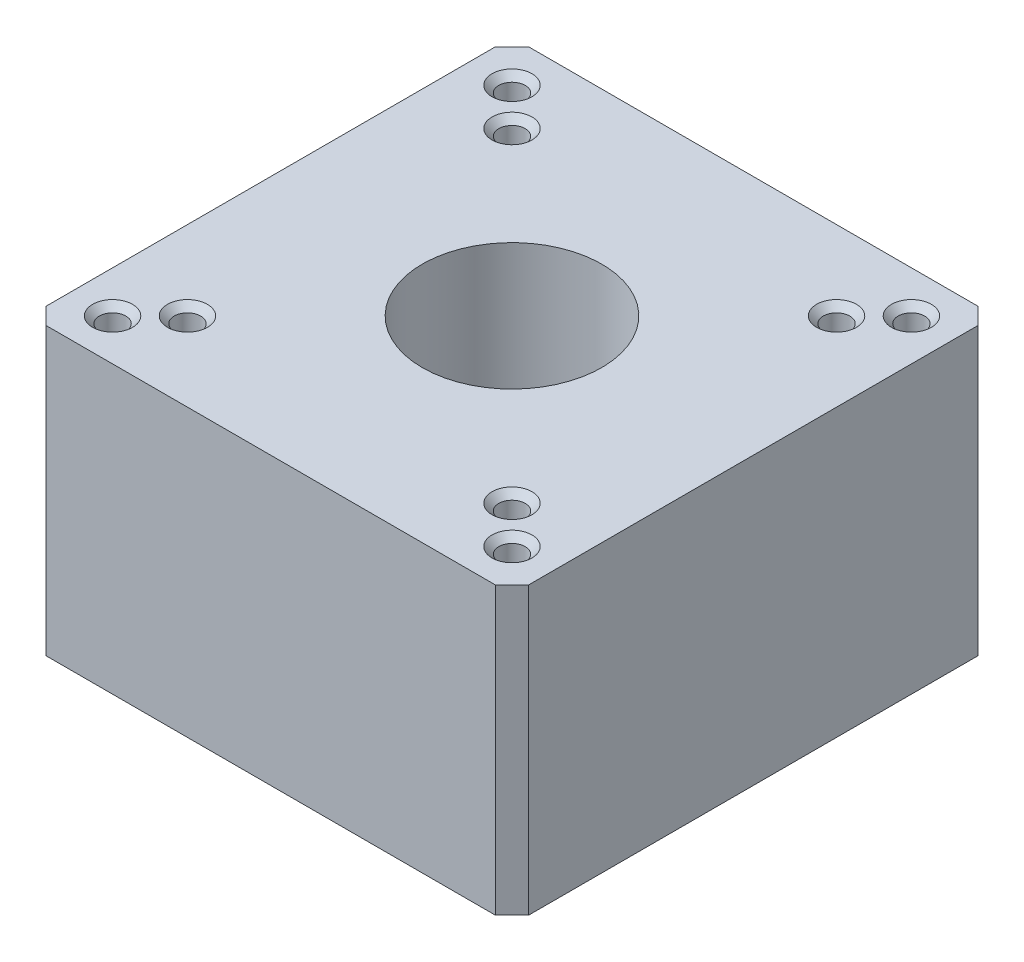
from build123d import *

# Parameters (mm, degrees)
SKETCH1_W                        = 73.66
SKETCH1_H                        = 73.66
SKETCH1_R                        = 13.6921875
BOSS_EXTRUDE1_DEPTH              = 43.65625
CHAMFER2_SIZE                    = 2.54
F_10_32_TAPPED_HOLE1_D           = 4.0386
F_10_32_TAPPED_HOLE1_CSINK_D     = 6.096
F_10_32_TAPPED_HOLE1_CSINK_ANGLE = 90
F_10_32_TAPPED_HOLE2_D           = 4.0386
F_10_32_TAPPED_HOLE2_DEPTH       = 21.844
F_10_32_TAPPED_HOLE2_CSINK_D     = 6.096
F_10_32_TAPPED_HOLE2_CSINK_ANGLE = 90
F_10_32_TAPPED_HOLE2_TIP         = 1.213317848


with BuildPart() as part:
    # Sketch1 → Boss-Extrude1 (new body)
    with BuildSketch(Plane(origin=(0, 0, 0), x_dir=(1, 0, 0), z_dir=(0, 1, 0))):
        Rectangle(SKETCH1_W, SKETCH1_H)
        with Locations(Location((0, 0, 0), (0, 0, 270))):
            Circle(SKETCH1_R, mode=Mode.SUBTRACT)
    extrude(amount=BOSS_EXTRUDE1_DEPTH)

    # Chamfer2
    chamfer2_edges = [part.edges().sort_by_distance(p)[0] for p in [
        (-36.83, 21.828125, -36.83),
        (36.83, 21.828125, -36.83),
        (36.83, 21.828125, 36.83),
        (-36.83, 21.828125, 36.83),
    ]]
    chamfer(chamfer2_edges, length=CHAMFER2_SIZE)

    # #10-32 Tapped Hole1 (through all)
    with Locations(Plane(origin=(0, 43.65625, 0), x_dir=(1, 0, 0), z_dir=(0, 1, 0))):
        with Locations((30.48, 30.48), (-30.48, 30.48), (-30.48, -30.48), (30.48, -30.48)):
            CounterSinkHole(F_10_32_TAPPED_HOLE1_D / 2, F_10_32_TAPPED_HOLE1_CSINK_D / 2, counter_sink_angle=F_10_32_TAPPED_HOLE1_CSINK_ANGLE)

    # #10-32 Tapped Hole2
    with Locations(Plane(origin=(0, 43.65625, 0), x_dir=(1, 0, 0), z_dir=(0, 1, 0))):
        with Locations((-24.765, 24.765), (24.765, 24.765), (-24.765, -24.765), (24.765, -24.765)):
            CounterSinkHole(F_10_32_TAPPED_HOLE2_D / 2, F_10_32_TAPPED_HOLE2_CSINK_D / 2, depth=F_10_32_TAPPED_HOLE2_DEPTH, counter_sink_angle=F_10_32_TAPPED_HOLE2_CSINK_ANGLE)
            with Locations((0, 0, -(F_10_32_TAPPED_HOLE2_DEPTH + F_10_32_TAPPED_HOLE2_TIP / 2))):  # 118° drill point
                Cone(0, F_10_32_TAPPED_HOLE2_D / 2, F_10_32_TAPPED_HOLE2_TIP, mode=Mode.SUBTRACT)


solid = part.part
